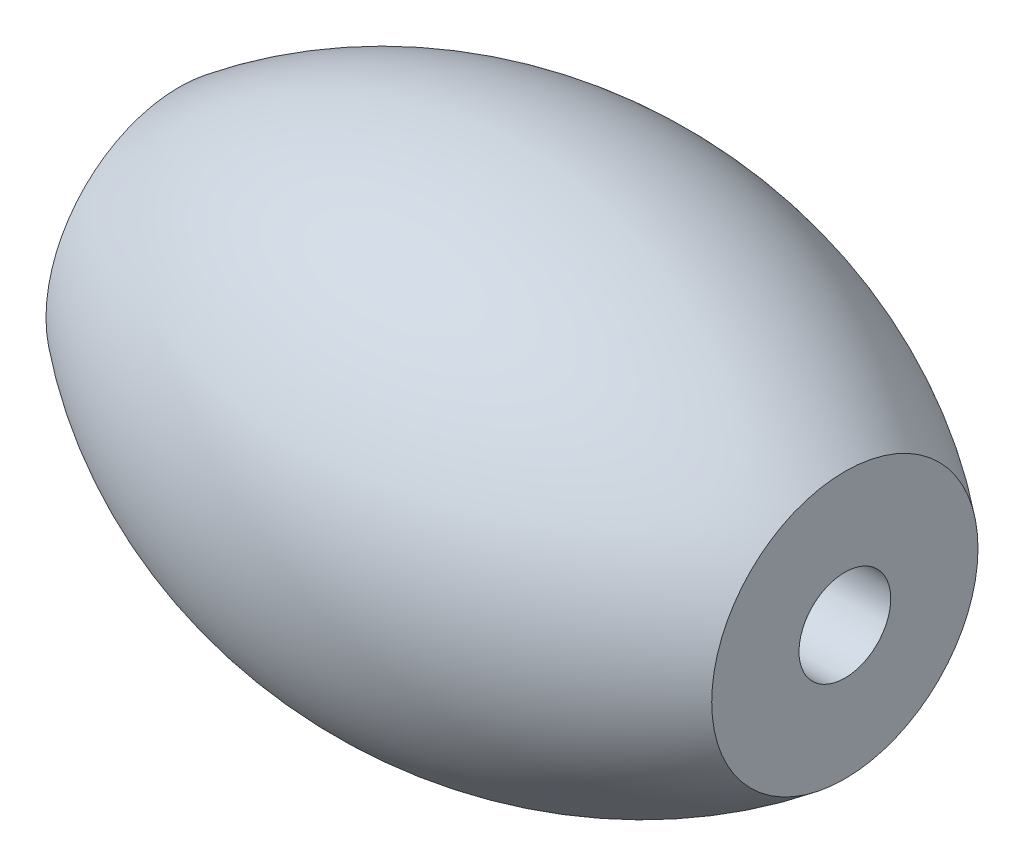
from build123d import *


with BuildPart() as part:
    # Sketch1 → Revolve1 (revolve)
    with BuildSketch(Plane.XY, mode=Mode.PRIVATE) as revolve1_sk:
        with BuildLine():
            Line((0, 1.75), (25.4, 1.75))
            Line((25.4, 1.75), (25.4, 5.08))
            ThreePointArc((25.4, 5.08), (12.7, 9.47), (0, 5.08))
            Line((0, 5.08), (0, 1.75))
        make_face()
    revolve(revolve1_sk.sketch.rotate(Axis((0, 0, 0), (1, 0, 0)), 180), axis=Axis((0, 0, 0), (1, 0, 0)))


solid = part.part
